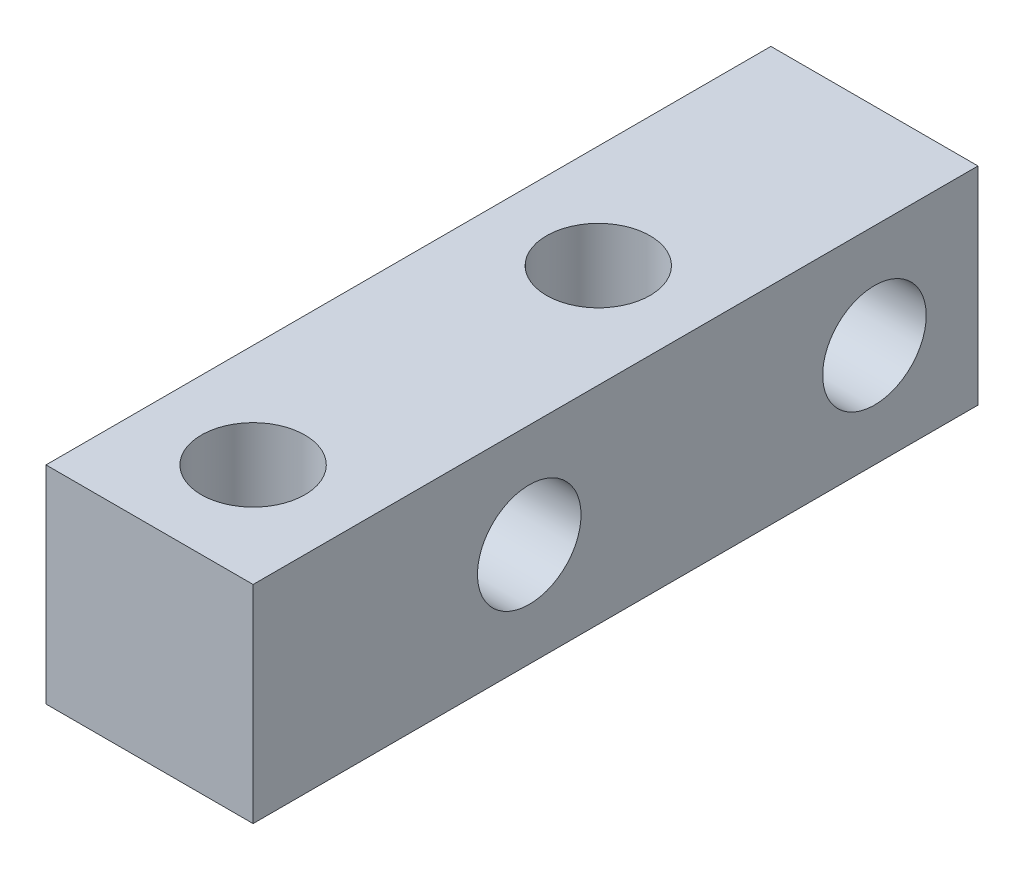
from build123d import *

# Parameters (mm, degrees)
SKETCH_1_W          = 6
SKETCH_1_H          = 21
SKETCH_1_R          = 1.5
EXTRUDE_1_DEPTH     = 6
SKETCH_2_R          = 1.5
CUT_EXTRUDE_1_DEPTH = 6


with BuildPart() as part:
    # 草图1 → 凸台-拉伸1 (new body)
    with BuildSketch(Plane(origin=(0, 0, 0), x_dir=(1, 0, 0), z_dir=(0, 1, 0))):
        with Locations((0, 7.5)):
            Rectangle(SKETCH_1_W, SKETCH_1_H)
        with Locations(Location((0, 0, 0), (0, 0, 270))):
            Circle(SKETCH_1_R, mode=Mode.SUBTRACT)
        with Locations(Location((0, 10, 0), (0, 0, 270))):
            Circle(SKETCH_1_R, mode=Mode.SUBTRACT)
    extrude(amount=EXTRUDE_1_DEPTH)

    # 草图2 → 切除-拉伸1 (cut)
    with BuildSketch(Plane(origin=(3, 0, 0), x_dir=(0, 0, -1), z_dir=(1, 0, 0))):
        with Locations((5, 3)):
            Circle(SKETCH_2_R)
        with Locations((15, 3)):
            Circle(SKETCH_2_R)
    extrude(amount=-CUT_EXTRUDE_1_DEPTH, mode=Mode.SUBTRACT)


solid = part.part
